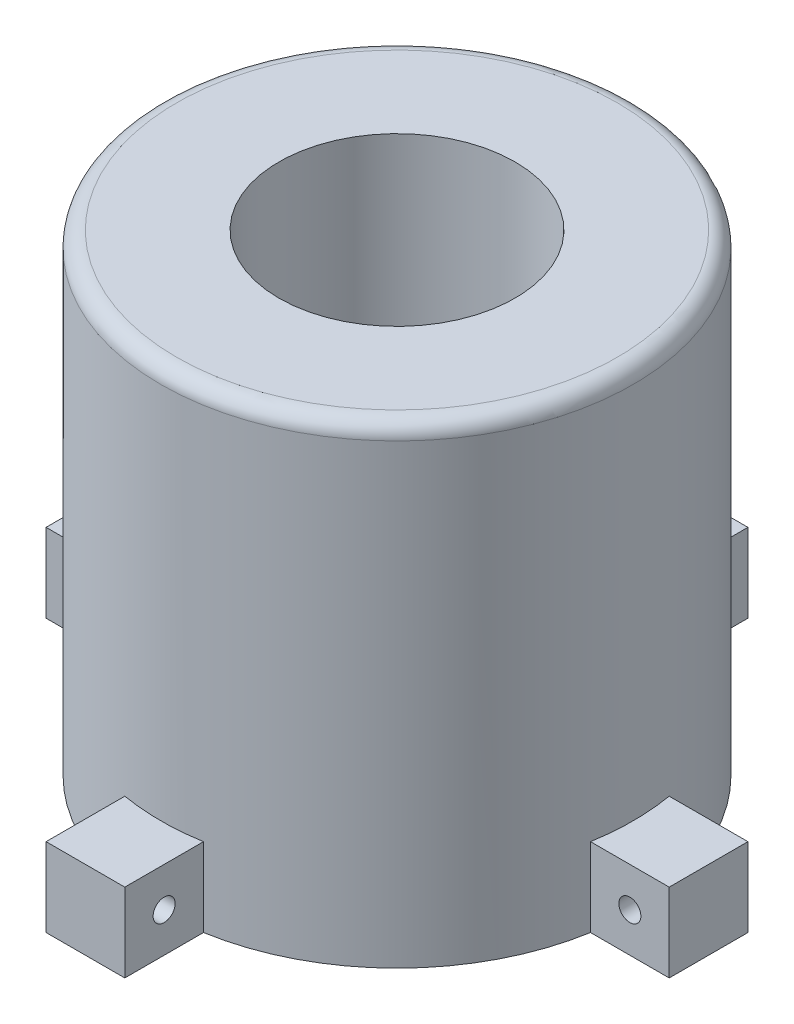
from build123d import *

# Parameters (mm, degrees)
SKETCH2_R           = 38.1
BOSS_EXTRUDE1_DEPTH = 76.2
SKETCH3_R           = 19.05
CUT_EXTRUDE1_DEPTH  = 76.2
FILLET1_R           = 2.54
BOSS_EXTRUDE2_DEPTH = 12.7
SKETCH5_R           = 1.778
CUT_EXTRUDE2_DEPTH  = 25.4
CIRPATTERN2_COUNT   = 4


with BuildPart() as part:
    # Sketch2 → Boss-Extrude1 (new body)
    with BuildSketch(Plane(origin=(0, 0, 0), x_dir=(1, 0, 0), z_dir=(0, 1, 0))):
        with Locations(Location((0, 0, 0), (0, 0, 90))):
            Circle(SKETCH2_R)
    extrude(amount=BOSS_EXTRUDE1_DEPTH)

    # Sketch3 → Cut-Extrude1 (cut)
    with BuildSketch(Plane(origin=(0, 76.2, 0), x_dir=(1, 0, 0), z_dir=(0, 1, 0))):
        with Locations(Location((0, 0, 0), (0, 0, 270))):
            Circle(SKETCH3_R)
    extrude(amount=-CUT_EXTRUDE1_DEPTH, mode=Mode.SUBTRACT)

    # Fillet1
    fillet1_edges = [part.edges().sort_by_distance(p)[0] for p in [
        (0, 76.2, 38.1),
    ]]
    fillet(fillet1_edges, radius=FILLET1_R)

    # Sketch4 → Boss-Extrude2 (add)
    with BuildSketch(Plane(origin=(0, 0, 0), x_dir=(1, 0, 0), z_dir=(0, 1, 0))):
        with BuildLine():
            Line((-37.567106623, 6.35), (-50.267106623, 6.35))
            Line((-50.267106623, 6.35), (-50.267106623, -6.35))
            Line((-50.267106623, -6.35), (-37.567106623, -6.35))
            ThreePointArc((-37.567106623, -6.35), (-38.1, 0), (-37.567106623, 6.35))
        make_face()
    boss_extrude2 = extrude(amount=BOSS_EXTRUDE2_DEPTH)

    # Sketch5 → Cut-Extrude2 (cut)
    with BuildSketch(Plane.XY.offset(6.35)):
        with Locations((-43.917106623, 6.35)):
            Circle(SKETCH5_R)
    cut_extrude2 = extrude(amount=-CUT_EXTRUDE2_DEPTH, mode=Mode.SUBTRACT)

    # CirPattern2: Boss-Extrude2, Cut-Extrude2 ×4 about axis
    cirpattern2_axis = Axis((0, 0, 0), (0, 1, 0))
    add([boss_extrude2.rotate(cirpattern2_axis, i * 360 / CIRPATTERN2_COUNT) for i in range(1, CIRPATTERN2_COUNT)])
    add([cut_extrude2.rotate(cirpattern2_axis, i * 360 / CIRPATTERN2_COUNT) for i in range(1, CIRPATTERN2_COUNT)], mode=Mode.SUBTRACT)


solid = part.part
